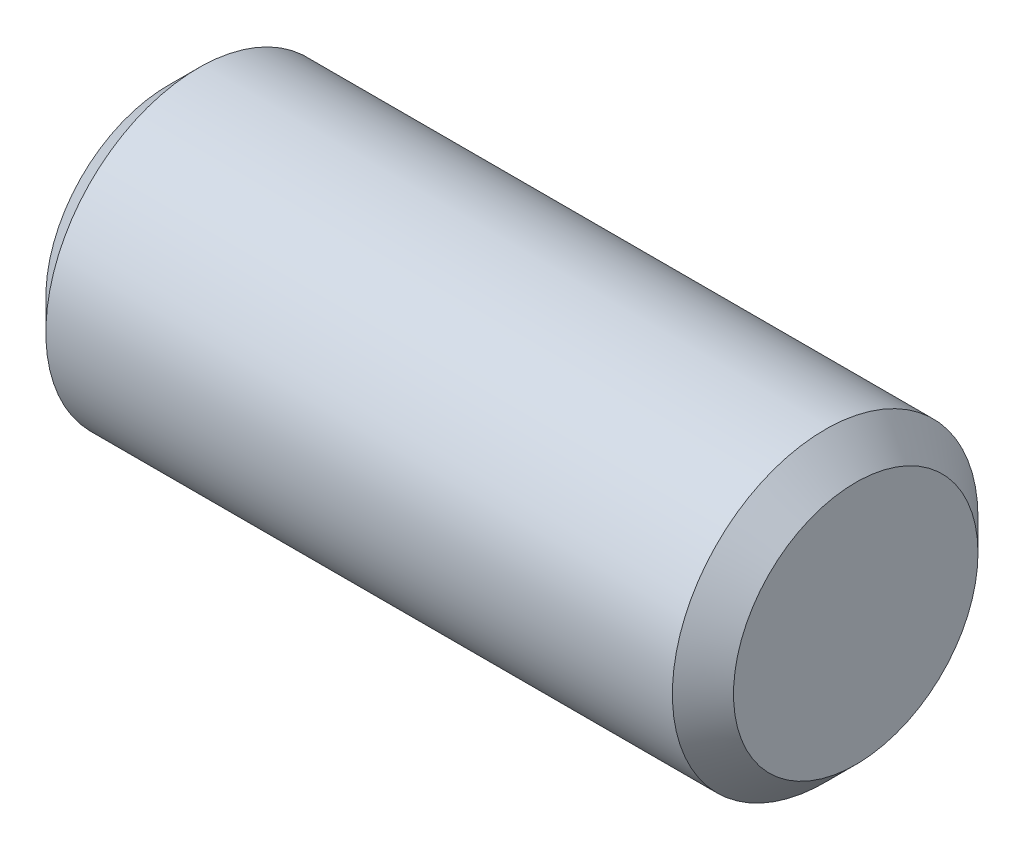
from build123d import *

# Parameters (mm, degrees)
EXTRUDE1_DEPTH      = 7.14375
EXTRUDE1_DEPTH_BACK = 7.14375
SKETCH2_R           = 3.175
CHAMFER1_SIZE       = 0.635


with BuildPart() as part:
    # Sketch2 → Extrude1 (new, two sides: drawn at the far end of the back side and taken through both)
    with BuildSketch(Plane(origin=(0, 0, 0), x_dir=(0, 0, -1), z_dir=(1, 0, 0)).offset(-EXTRUDE1_DEPTH_BACK)):
        Circle(SKETCH2_R)
    extrude(amount=EXTRUDE1_DEPTH + EXTRUDE1_DEPTH_BACK)

    # Chamfer1
    chamfer1_edges = [part.edges().sort_by_distance(p)[0] for p in [
        (-7.14375, 0, 3.175),
        (7.14375, 0, 3.175),
    ]]
    chamfer(chamfer1_edges, length=CHAMFER1_SIZE)


solid = part.part
